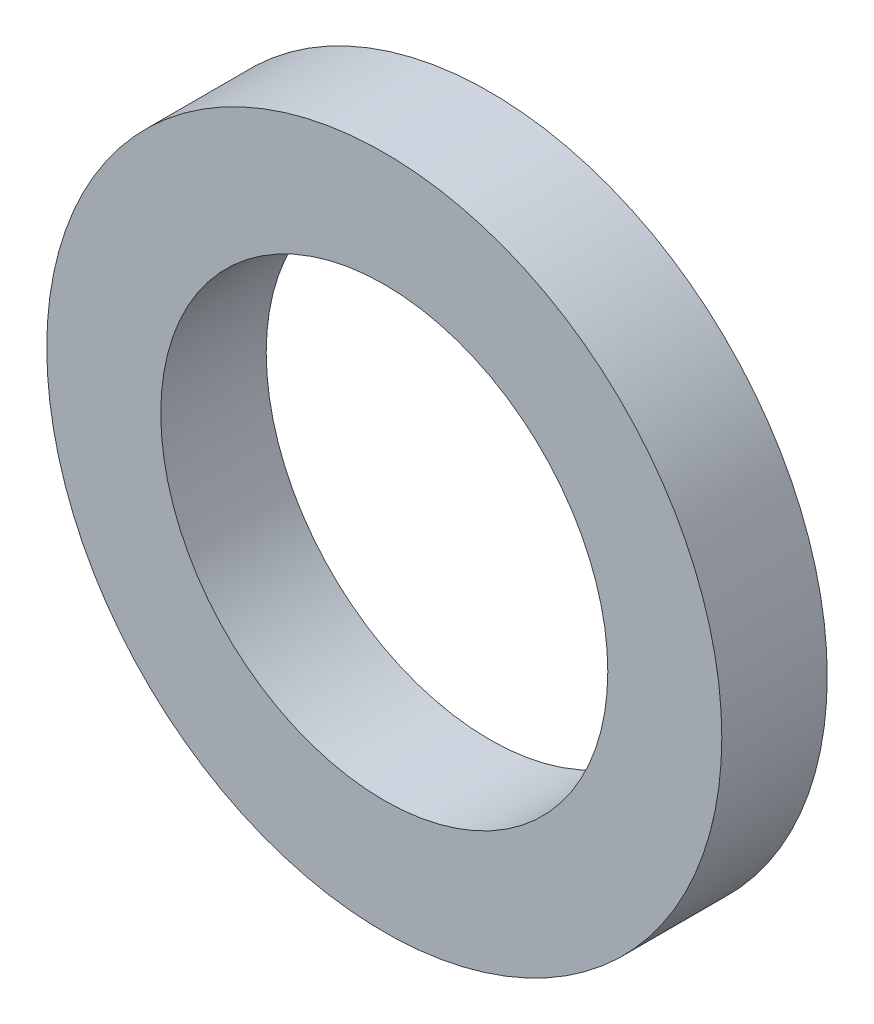
from build123d import *

# Parameters (mm, degrees)
SKETCH1_R           = 4.801969539
SKETCH1_R_2         = 3.18
BOSS_EXTRUDE1_DEPTH = 1.5


with BuildPart() as part:
    # Sketch1 → Boss-Extrude1 (new body)
    with BuildSketch(Plane.XY):
        Circle(SKETCH1_R)
        Circle(SKETCH1_R_2, mode=Mode.SUBTRACT)
    extrude(amount=BOSS_EXTRUDE1_DEPTH)


solid = part.part
